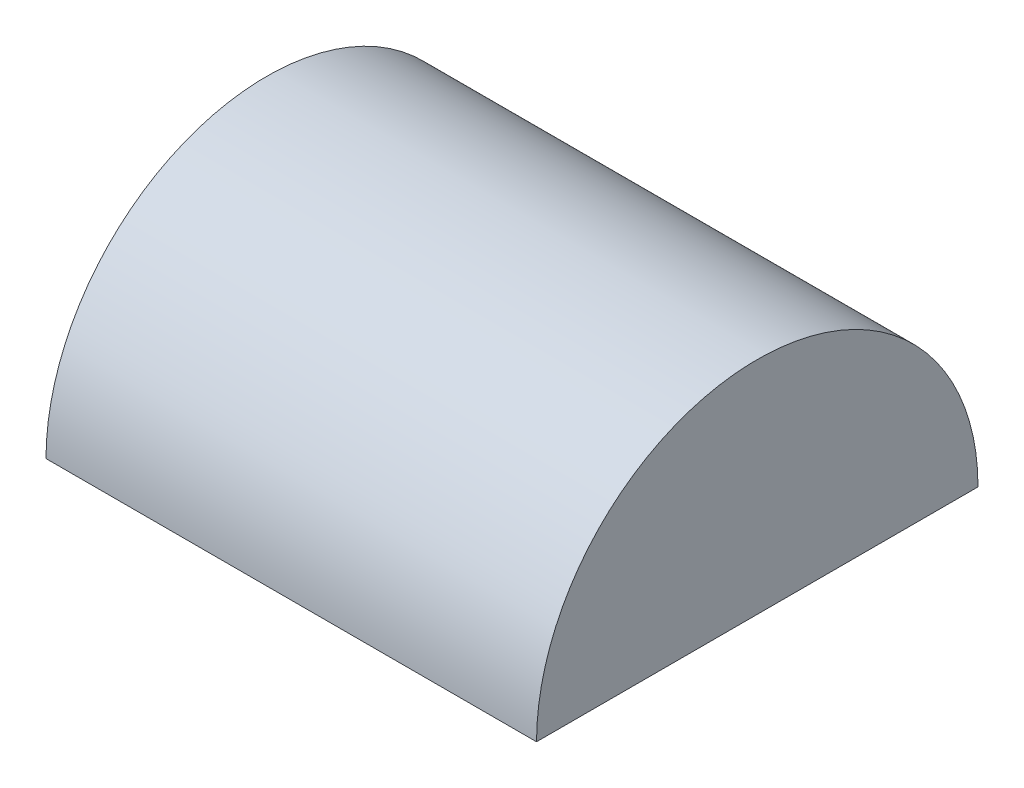
from build123d import *

# Parameters (mm, degrees)
EXTRUDE_1_DEPTH = 80


with BuildPart() as part:
    # 草图1 → 凸台-拉伸1 (new body)
    with BuildSketch(Plane(origin=(0, 0, 0), x_dir=(0, 0, -1), z_dir=(1, 0, 0))):
        with BuildLine():
            Line((-36, 0), (36, 0))
            ThreePointArc((36, 0), (0, 36), (-36, 0))
        make_face()
    extrude(amount=EXTRUDE_1_DEPTH)


solid = part.part
